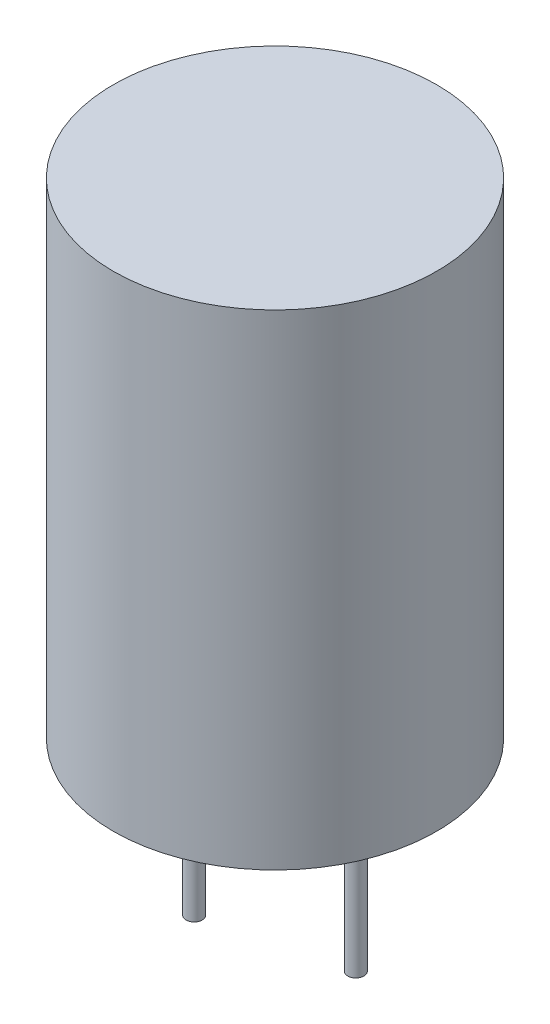
from build123d import *

# Parameters (mm, degrees)
SKETCH_1_R      = 10
EXTRUDE_1_DEPTH = 30
SKETCH_2_R      = 0.5
EXTRUDE_2_DEPTH = 12
SKETCH_3_R      = 0.5
EXTRUDE_3_DEPTH = 10


with BuildPart() as part:
    # 草图1 → 拉伸1 (new body)
    with BuildSketch(Plane(origin=(0, 0, 0), x_dir=(1, 0, 0), z_dir=(0, 1, 0))):
        with Locations(Location((0, 0, 0), (0, 0, 270))):
            Circle(SKETCH_1_R)
    extrude(amount=EXTRUDE_1_DEPTH)

    # 草图2 → 拉伸2 (add)
    with BuildSketch(Plane.XZ):
        with Locations(Location((-5, 0, 0), (0, 0, 90))):
            Circle(SKETCH_2_R)
    extrude(amount=EXTRUDE_2_DEPTH)

    # 草图3 → 拉伸3 (add)
    with BuildSketch(Plane.XZ):
        with Locations(Location((5, 0, 0), (0, 0, 90))):
            Circle(SKETCH_3_R)
    extrude(amount=EXTRUDE_3_DEPTH)


solid = part.part
